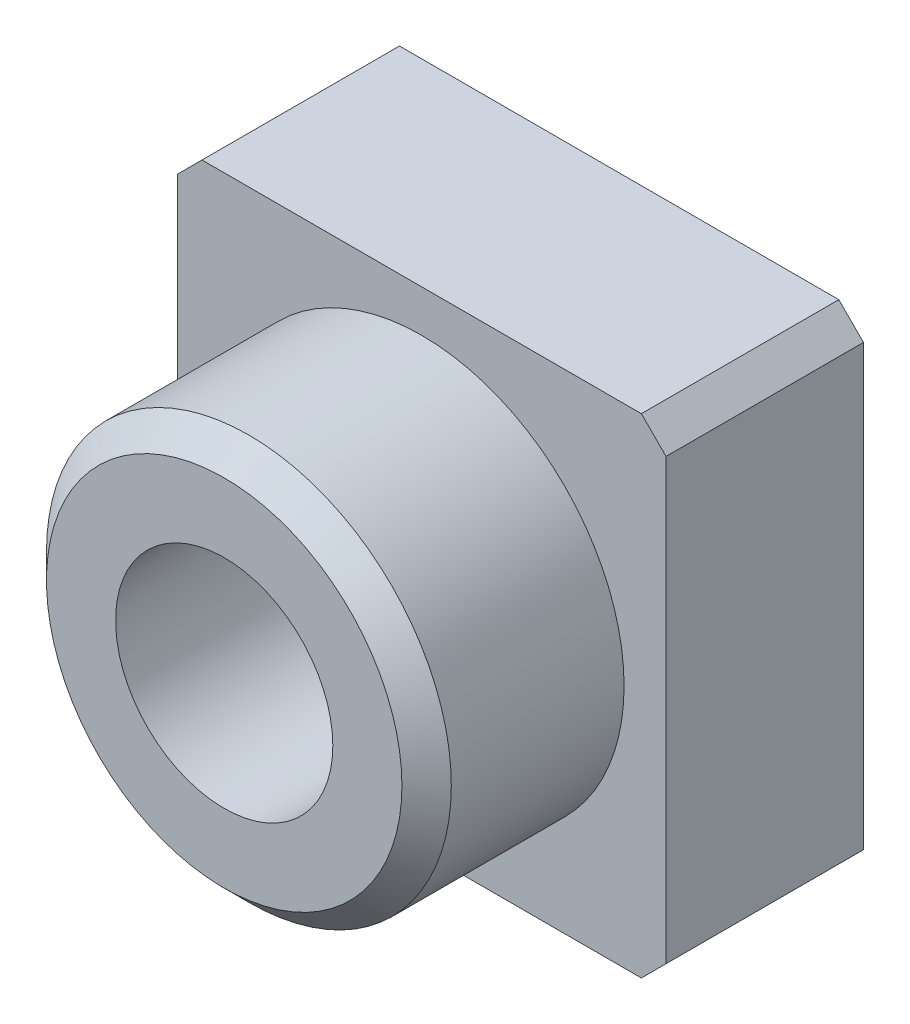
from build123d import *

# Parameters (mm, degrees)
ESQUISSE1_W             = 9.9
ESQUISSE1_H             = 9.9
BOSS_EXTRU_1_DEPTH      = 4
ENL_V_MAT_EXTRU_1_DEPTH = 3.2
ESQUISSE4_R             = 4.1
BOSS_EXTRU_2_DEPTH      = 4
CHANFREIN1_SIZE         = 0.5
ESQUISSE5_R             = 2.2
ENL_V_MAT_EXTRU_3_DEPTH = 11.63038099
CHANFREIN2_SIZE         = 0.5


with BuildPart() as part:
    # Esquisse1 → Boss.-Extru.1 (new body)
    with BuildSketch(Plane.XY):
        Rectangle(ESQUISSE1_W, ESQUISSE1_H)
    extrude(amount=BOSS_EXTRU_1_DEPTH)

    # Esquisse2 → Enlèv. mat.-Extru.1 (cut)
    with BuildSketch(Plane.XY):
        Polygon((4.156921938, 0), (2.078460969, 3.6), (-2.078460969, 3.6), (-4.156921938, 0), (-2.078460969, -3.6), (2.078460969, -3.6), align=None)
    extrude(amount=ENL_V_MAT_EXTRU_1_DEPTH, mode=Mode.SUBTRACT)

    # Esquisse4 → Boss.-Extru.2 (add)
    with BuildSketch(Plane.XY.offset(4)):
        Circle(ESQUISSE4_R)
    extrude(amount=BOSS_EXTRU_2_DEPTH)

    # Chanfrein1
    chanfrein1_edges = [part.edges().sort_by_distance(p)[0] for p in [
        (-4.1, 0, 8),
    ]]
    chamfer(chanfrein1_edges, length=CHANFREIN1_SIZE)

    # Esquisse5 → Enlèv. mat.-Extru.3 (cut, through all)
    with BuildSketch(Plane.XY.offset(8)):
        Circle(ESQUISSE5_R)
    extrude(amount=-ENL_V_MAT_EXTRU_3_DEPTH, mode=Mode.SUBTRACT)

    # Chanfrein2
    chanfrein2_edges = [part.edges().sort_by_distance(p)[0] for p in [
        (4.95, -4.95, 2),
        (-4.95, -4.95, 2),
        (-4.95, 4.95, 2),
        (4.95, 4.95, 2),
    ]]
    chamfer(chanfrein2_edges, length=CHANFREIN2_SIZE)


solid = part.part
